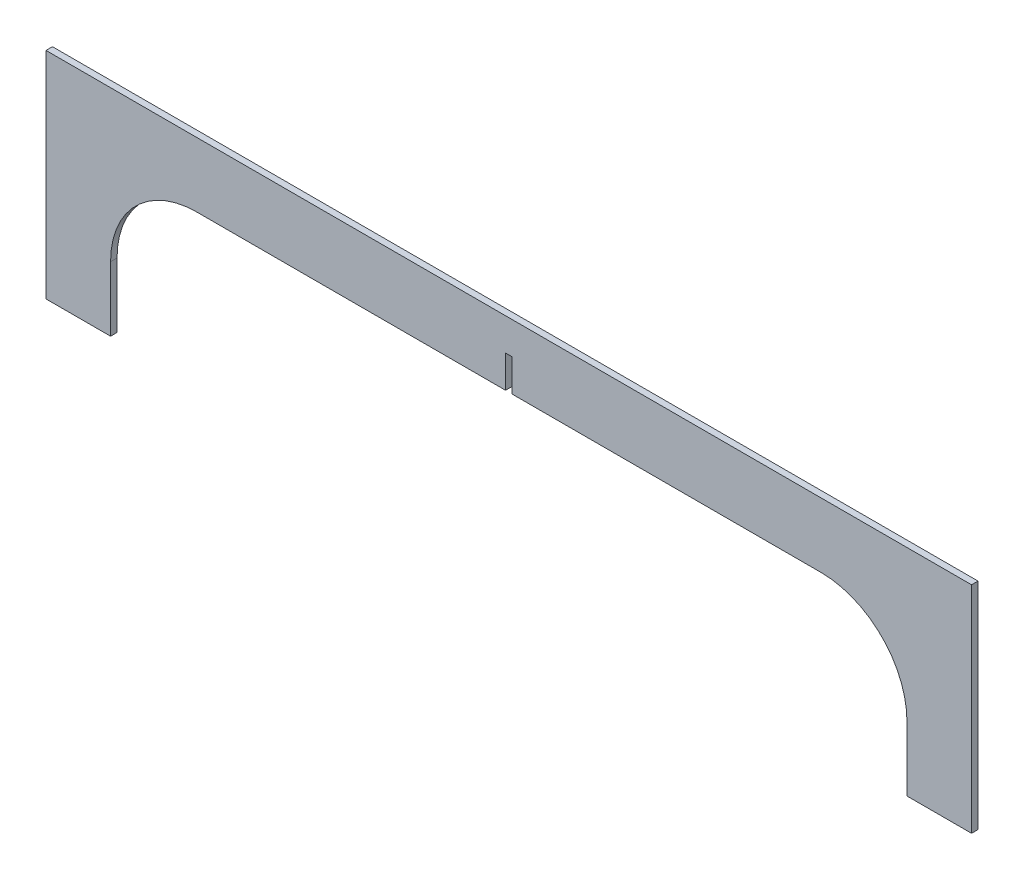
from build123d import *

# Parameters (mm, degrees)
BOSS_EXTRUDE1_DEPTH = 3
FILLET1_R           = 40


with BuildPart() as part:
    # Sketch1 → Boss-Extrude1 (new body)
    with BuildSketch(Plane.XY):
        Polygon((0, 0), (0, 100), (430, 100), (430, 0), (400, 0), (400, 70), (216.5, 70), (216.5, 85), (213.5, 85), (213.5, 70), (30, 70), (30, 0), align=None)
    extrude(amount=BOSS_EXTRUDE1_DEPTH)

    # Fillet1
    fillet1_edges = [part.edges().sort_by_distance(p)[0] for p in [
        (400, 70, 1.5),
        (30, 70, 1.5),
    ]]
    fillet(fillet1_edges, radius=FILLET1_R)


solid = part.part
